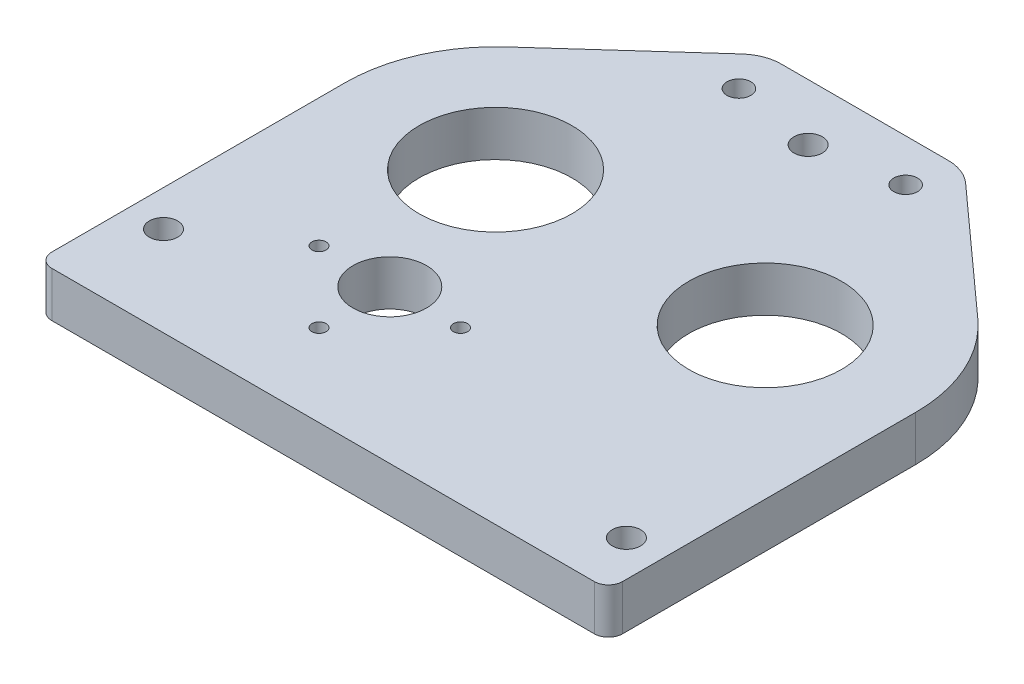
from build123d import *

# Parameters (mm, degrees)
SKETCH1_R           = 13.5001
SKETCH1_R_2         = 6.5
SKETCH1_R_3         = 2.1
SKETCH1_R_4         = 2.5
SKETCH1_R_5         = 1.25
BOSS_EXTRUDE1_DEPTH = 8.001
FILLET1_R           = 2.5


with BuildPart() as part:
    # Sketch1 → Boss-Extrude1 (new body)
    with BuildSketch(Plane(origin=(0, 0, 0), x_dir=(1, 0, 0), z_dir=(0, 1, 0))):
        with BuildLine():
            Line((-35.1724, 27.25881268), (-35.1724, -27.025))
            Line((-35.1724, -27.025), (65.6524, -27.025))
            Line((65.6524, -27.025), (65.6524, 27.25881268))
            ThreePointArc((65.6524, 27.25881268), (63.355608012, 38.071472897), (56.861869136, 47.016875617))
            Line((56.861869136, 47.016875617), (34.989131558, 66.732353738))
            ThreePointArc((34.989131558, 66.732353738), (32.657534218, 68.162444257), (29.968168585, 68.661260389))
            Line((29.968168585, 68.661260389), (0.511831415, 68.661260389))
            ThreePointArc((0.511831415, 68.661260389), (-2.177534218, 68.162444257), (-4.509131558, 66.732353738))
            Line((-4.509131558, 66.732353738), (-26.381869136, 47.016875617))
            ThreePointArc((-26.381869136, 47.016875617), (-32.875608012, 38.071472897), (-35.1724, 27.25881268))
        make_face()
        with Locations(Location((-8.5725, 27.25881268, 0), (0, 0, 270))):
            Circle(SKETCH1_R, mode=Mode.SUBTRACT)
        with Locations(Location((39.0525, 27.25881268, 0), (0, 0, 270))):
            Circle(SKETCH1_R, mode=Mode.SUBTRACT)
        with Locations(Location((0, 0, 0), (0, 0, 270))):
            Circle(SKETCH1_R_2, mode=Mode.SUBTRACT)
        with Locations(Location((0.511831415, 61.161999075, 0), (0, 0, 270))):
            Circle(SKETCH1_R_3, mode=Mode.SUBTRACT)
        with Locations(Location((29.968168585, 61.161999075, 0), (0, 0, 270))):
            Circle(SKETCH1_R_3, mode=Mode.SUBTRACT)
        with Locations(Location((-28.8224, -11.15, 0), (0, 0, 270))):
            Circle(SKETCH1_R_4, mode=Mode.SUBTRACT)
        with Locations(Location((59.3024, -17.5, 0), (0, 0, 270))):
            Circle(SKETCH1_R_4, mode=Mode.SUBTRACT)
        with Locations(Location((15.24, 58.661260389, 0), (0, 0, 270))):
            Circle(SKETCH1_R_4, mode=Mode.SUBTRACT)
        with Locations(Location((12.5, 0, 0), (0, 0, 270))):
            Circle(SKETCH1_R_5, mode=Mode.SUBTRACT)
        with Locations(Location((0, -12.5, 0), (0, 0, 270))):
            Circle(SKETCH1_R_5, mode=Mode.SUBTRACT)
        with Locations(Location((-12.5, 0, 0), (0, 0, 270))):
            Circle(SKETCH1_R_5, mode=Mode.SUBTRACT)
    extrude(amount=BOSS_EXTRUDE1_DEPTH)

    # Fillet1
    fillet1_edges = [part.edges().sort_by_distance(p)[0] for p in [
        (65.6524, 4.0005, 27.025),
        (-35.1724, 4.0005, 27.025),
    ]]
    fillet(fillet1_edges, radius=FILLET1_R)


solid = part.part
